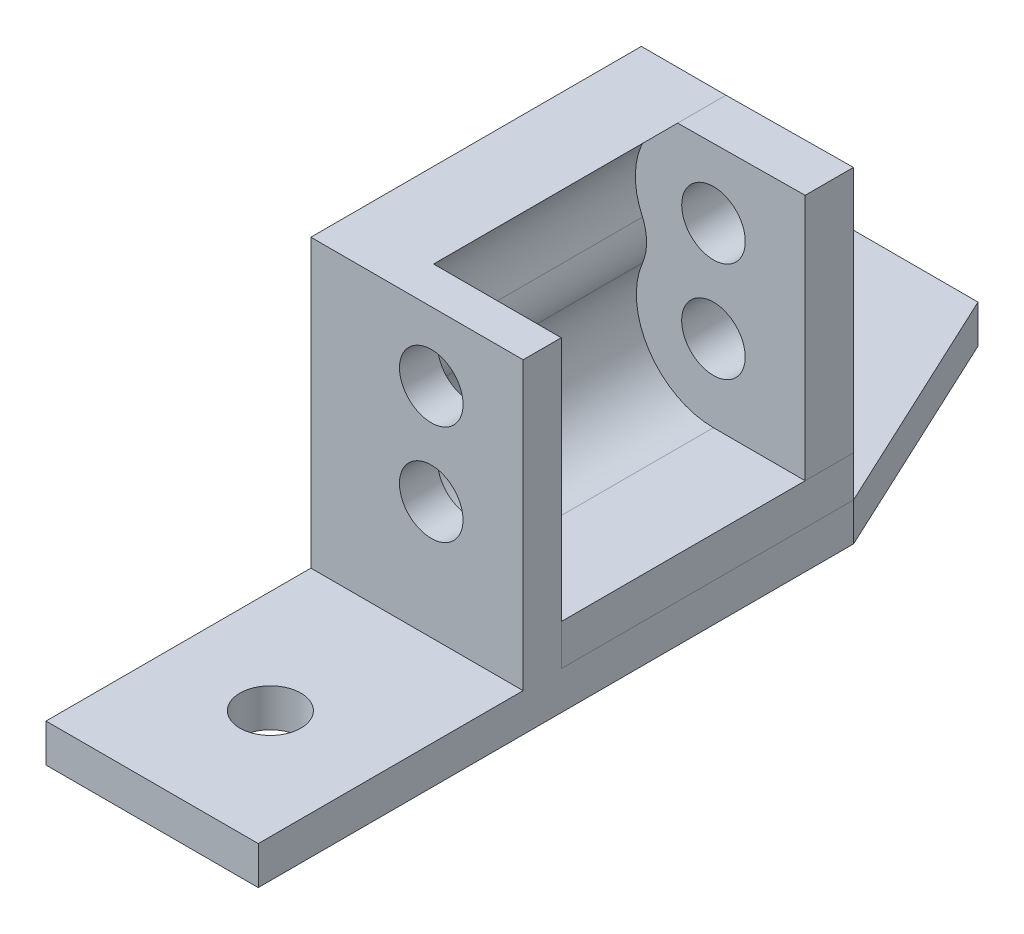
from build123d import *

# Parameters (mm, degrees)
BOSS_EXTRUDE1_DEPTH = 29.21
SKETCH2_W           = 21.206924152
SKETCH2_H           = 28.633723015
SKETCH2_R           = 3.175
BOSS_EXTRUDE2_DEPTH = 3.81
BOSS_EXTRUDE3_START = -4.826
SKETCH3_R           = 3.175
BOSS_EXTRUDE3_DEPTH = 4.826
SKETCH4_R           = 2.924709064
SKETCH4_R_2         = 3.042286042
BOSS_EXTRUDE4_DEPTH = 3.81


with BuildPart() as part:
    # Sketch1 → Boss-Extrude1 (new body)
    with BuildSketch(Plane.XY):
        with BuildLine():
            Line((92.017977945, 102.236000374), (113.224902097, 102.236000374))
            Line((113.224902097, 102.236000374), (113.210298678, 106.295173442))
            Line((113.210298678, 106.295173442), (104.041152894, 106.300000374))
            ThreePointArc((104.041152894, 106.300000374), (97.620882741, 109.755229578), (96.960558709, 117.016252224))
            ThreePointArc((96.960558709, 117.016252224), (97.366531104, 119.0035195), (96.962652269, 120.991213315))
            ThreePointArc((96.962652269, 120.991213315), (96.669783853, 126.656600471), (100.468728286, 130.869723389))
            Line((100.468728286, 130.869723389), (92.017977945, 130.869723389))
            Line((92.017977945, 130.869723389), (92.017977945, 102.236000374))
        make_face()
    extrude(amount=-BOSS_EXTRUDE1_DEPTH)

    # Sketch2 → Boss-Extrude2 (add)
    with BuildSketch(Plane.XY):
        with Locations((102.621440021, 116.552861882)):
            Rectangle(SKETCH2_W, SKETCH2_H)
        with Locations(Location((104.05047074, 124, 0), (0, 0, 180))):
            Circle(SKETCH2_R, mode=Mode.SUBTRACT)
        with Locations(Location((104.04520642, 114, 0), (0, 0, 180))):
            Circle(SKETCH2_R, mode=Mode.SUBTRACT)
    extrude(amount=BOSS_EXTRUDE2_DEPTH)

    # Sketch3 → Boss-Extrude3 (add)
    with BuildSketch(Plane(origin=(0, 0, -29.21), x_dir=(-1, 0, 0), z_dir=(0, 0, -1)).offset(BOSS_EXTRUDE3_START)):
        with BuildLine():
            Line((-113.210298678, 106.295173442), (-113.210298678, 130.994991711))
            Line((-113.210298678, 130.994991711), (-100.468728286, 130.869723389))
            ThreePointArc((-100.468728286, 130.869723389), (-96.669783853, 126.656600471), (-96.962652269, 120.991213315))
            ThreePointArc((-96.962652269, 120.991213315), (-97.366531104, 119.0035195), (-96.960558709, 117.016252224))
            ThreePointArc((-96.960558709, 117.016252224), (-97.620882741, 109.755229578), (-104.041152894, 106.300000374))
            Line((-104.041152894, 106.300000374), (-113.210298678, 106.295173442))
        make_face()
        with Locations((-104.04520642, 114)):
            Circle(SKETCH3_R, mode=Mode.SUBTRACT)
        with Locations((-104.05047074, 124)):
            Circle(SKETCH3_R, mode=Mode.SUBTRACT)
    extrude(amount=BOSS_EXTRUDE3_DEPTH)

    # Sketch4 → Boss-Extrude4 (add)
    with BuildSketch(Plane(origin=(0, 102.236000374, 0), x_dir=(1, 0, 0), z_dir=(0, 1, 0))):
        Polygon((92.017977945, -3.81), (92.017977945, -30.273157469), (113.224902097, -30.273157469), (113.224902097, -3.81), (113.224902097, 29.21), (102.326996441, 52.536371302), (80.454002019, 52.536371302), (92.017977945, 29.21), align=None)
        with Locations(Location((96.881668056, 40.935379723, 0), (0, 0, 270))):
            Circle(SKETCH4_R, mode=Mode.SUBTRACT)
        with Locations(Location((102.326996441, -18.162627323, 0), (0, 0, 270))):
            Circle(SKETCH4_R_2, mode=Mode.SUBTRACT)
    extrude(amount=-BOSS_EXTRUDE4_DEPTH)


solid = part.part
